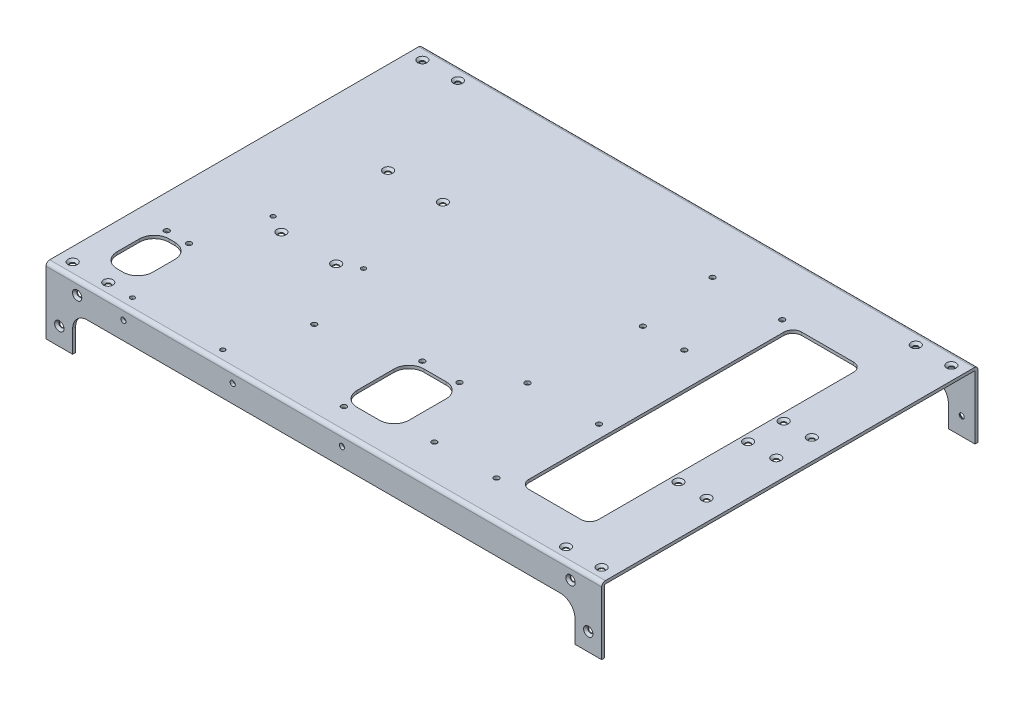
from build123d import *

# Parameters (mm, degrees)
BOSS_EXTRUDE1_DEPTH                             = 187.5
CUT_EXTRUDE1_DEPTH                              = 332.319332367
CUT_EXTRUDE4_DEPTH                              = 10
SKETCH6_R                                       = 1.5
CUT_EXTRUDE5_DEPTH                              = 319.900062716
SKETCH9_R                                       = 1.5
CUT_EXTRUDE8_DEPTH                              = 10
SKETCH19_R                                      = 1.5
CUT_EXTRUDE9_DEPTH                              = 10
SKETCH20_R                                      = 1.75
CUT_EXTRUDE10_DEPTH                             = 319.900062716
CSK_FOR_M3_FLAT_HEAD_MACHINE_SCREW1_D           = 3.4
CSK_FOR_M3_FLAT_HEAD_MACHINE_SCREW1_DEPTH       = 10
CSK_FOR_M3_FLAT_HEAD_MACHINE_SCREW1_CSINK_D     = 6.3
CSK_FOR_M3_FLAT_HEAD_MACHINE_SCREW1_CSINK_ANGLE = 90
CSK_FOR_M3_FLAT_HEAD_MACHINE_SCREW1_TIP         = 1.021463052
CSK_FOR_M3_FLAT_HEAD_MACHINE_SCREW2_D           = 3.4
CSK_FOR_M3_FLAT_HEAD_MACHINE_SCREW2_DEPTH       = 10
CSK_FOR_M3_FLAT_HEAD_MACHINE_SCREW2_CSINK_D     = 6.3
CSK_FOR_M3_FLAT_HEAD_MACHINE_SCREW2_CSINK_ANGLE = 90
CSK_FOR_M3_FLAT_HEAD_MACHINE_SCREW2_TIP         = 1.021463052
CSK_FOR_M3_FLAT_HEAD_MACHINE_SCREW3_D           = 3.4
CSK_FOR_M3_FLAT_HEAD_MACHINE_SCREW3_DEPTH       = 10
CSK_FOR_M3_FLAT_HEAD_MACHINE_SCREW3_CSINK_D     = 6.3
CSK_FOR_M3_FLAT_HEAD_MACHINE_SCREW3_CSINK_ANGLE = 90
CSK_FOR_M3_FLAT_HEAD_MACHINE_SCREW3_TIP         = 1.021463052
SKETCH28_R                                      = 1.75
CUT_EXTRUDE11_DEPTH                             = 10
SKETCH29_R                                      = 1.75
CUT_EXTRUDE12_DEPTH                             = 10
SKETCH30_R                                      = 1.75
CUT_EXTRUDE13_DEPTH                             = 231.508676626


with BuildPart() as part:
    # Sketch1 → Boss-Extrude1 (new, symmetric)
    with BuildSketch(Plane(origin=(0, 0, 0), x_dir=(0, 0, -1), z_dir=(1, 0, 0))):
        with BuildLine():
            Line((125, -100.5), (127, -100.5))
            Line((127, -100.5), (127, -2.5))
            ThreePointArc((127, -2.5), (126.267766953, -0.732233047), (124.5, 0))
            Line((124.5, 0), (-124.5, 0))
            ThreePointArc((-124.5, 0), (-126.267766953, -0.732233047), (-127, -2.5))
            Line((-127, -2.5), (-127, -100.5))
            Line((-127, -100.5), (-125, -100.5))
            Line((-125, -100.5), (-125, -2.5))
            ThreePointArc((-125, -2.5), (-124.853553391, -2.146446609), (-124.5, -2))
            Line((-124.5, -2), (124.5, -2))
            ThreePointArc((124.5, -2), (124.853553391, -2.146446609), (125, -2.5))
            Line((125, -2.5), (125, -100.5))
        make_face()
    extrude(amount=BOSS_EXTRUDE1_DEPTH, both=True)

    # Sketch2 → Cut-Extrude1 (cut, through all)
    with BuildSketch(Plane.XY.offset(127)):
        with BuildLine():
            Line((187.5, -45), (187.5, -100.5))
            Line((187.5, -100.5), (-187.5, -100.5))
            Line((-187.5, -100.5), (-187.5, -45))
            Line((-187.5, -45), (-169.5, -45))
            Line((-169.5, -45), (-169.5, -30))
            ThreePointArc((-169.5, -30), (-166.571067812, -22.928932188), (-159.5, -20))
            Line((-159.5, -20), (159.5, -20))
            ThreePointArc((159.5, -20), (166.571067812, -22.928932188), (169.5, -30))
            Line((169.5, -30), (169.5, -45))
            Line((169.5, -45), (187.5, -45))
        make_face()
    extrude(amount=-CUT_EXTRUDE1_DEPTH, mode=Mode.SUBTRACT)

    # Sketch5 → Cut-Extrude4 (cut)
    with BuildSketch(Plane.XZ.offset(2)):
        with BuildLine():
            Line((108.5, 97), (143.5, 97))
            ThreePointArc((143.5, 97), (147.742640687, 95.242640687), (149.5, 91))
            Line((149.5, 91), (149.5, -81))
            ThreePointArc((149.5, -81), (147.742640687, -85.242640687), (143.5, -87))
            Line((143.5, -87), (108.5, -87))
            ThreePointArc((108.5, -87), (104.257359313, -85.242640687), (102.5, -81))
            Line((102.5, -81), (102.5, 91))
            ThreePointArc((102.5, 91), (104.257359313, 95.242640687), (108.5, 97))
        make_face()
    extrude(amount=-CUT_EXTRUDE4_DEPTH, mode=Mode.SUBTRACT)

    # Sketch6 → Cut-Extrude5 (cut, through all)
    with BuildSketch(Plane(origin=(0, 0, -127), x_dir=(-1, 0, 0), z_dir=(0, 0, -1))):
        with Locations((-178.5, -33)):
            Circle(SKETCH6_R)
        with Locations((-166.5, -9)):
            Circle(SKETCH6_R)
        with Locations((166.5, -9)):
            Circle(SKETCH6_R)
        with Locations((178.5, -33)):
            Circle(SKETCH6_R)
    extrude(amount=-CUT_EXTRUDE5_DEPTH, mode=Mode.SUBTRACT)

    # Sketch9 → Cut-Extrude8 (cut)
    with BuildSketch(Plane(origin=(0, 0, 0), x_dir=(1, 0, 0), z_dir=(0, 1, 0))):
        with Locations(Location((-178.5, 118, 0), (0, 0, 270))):
            Circle(SKETCH9_R)
        with Locations(Location((-154.5, 118, 0), (0, 0, 270))):
            Circle(SKETCH9_R)
        with Locations(Location((154.5, 118, 0), (0, 0, 270))):
            Circle(SKETCH9_R)
        with Locations(Location((178.5, 118, 0), (0, 0, 270))):
            Circle(SKETCH9_R)
        with Locations(Location((178.5, -118, 0), (0, 0, 270))):
            Circle(SKETCH9_R)
        with Locations(Location((154.5, -118, 0), (0, 0, 270))):
            Circle(SKETCH9_R)
        with Locations(Location((-154.5, -118, 0), (0, 0, 270))):
            Circle(SKETCH9_R)
        with Locations(Location((-178.5, -118, 0), (0, 0, 270))):
            Circle(SKETCH9_R)
        with Locations(Location((-125.5, 41.85, 0), (0, 0, 270))):
            Circle(SKETCH9_R)
        with Locations(Location((-88.5, 41.85, 0), (0, 0, 270))):
            Circle(SKETCH9_R)
        with Locations(Location((-125.5, -30.15, 0), (0, 0, 270))):
            Circle(SKETCH9_R)
        with Locations(Location((-88.5, -30.15, 0), (0, 0, 270))):
            Circle(SKETCH9_R)
        with Locations(Location((154.5, 28.85, 0), (0, 0, 270))):
            Circle(SKETCH9_R)
        with Locations(Location((173.5, 4.85, 0), (0, 0, 270))):
            Circle(SKETCH9_R)
        with Locations(Location((154.5, 4.85, 0), (0, 0, 270))):
            Circle(SKETCH9_R)
        with Locations(Location((173.5, 28.85, 0), (0, 0, 270))):
            Circle(SKETCH9_R)
        with Locations(Location((154.5, -42.15, 0), (0, 0, 270))):
            Circle(SKETCH9_R)
        with Locations(Location((173.5, -42.15, 0), (0, 0, 270))):
            Circle(SKETCH9_R)
    extrude(amount=-CUT_EXTRUDE8_DEPTH, mode=Mode.SUBTRACT)

    # Sketch19 → Cut-Extrude9 (cut)
    with BuildSketch(Plane(origin=(0, 0, 0), x_dir=(1, 0, 0), z_dir=(0, 1, 0))):
        with Locations(Location((-137.5, -23.7, 0), (0, 0, 270))):
            Circle(SKETCH19_R)
        with Locations(Location((-76.5, -23.7, 0), (0, 0, 270))):
            Circle(SKETCH19_R)
        with Locations(Location((-76.5, -118.7, 0), (0, 0, 270))):
            Circle(SKETCH19_R)
        with Locations(Location((-137.5, -118.7, 0), (0, 0, 270))):
            Circle(SKETCH19_R)
    extrude(amount=-CUT_EXTRUDE9_DEPTH, mode=Mode.SUBTRACT)

    # Sketch20 → Cut-Extrude10 (cut, through all)
    with BuildSketch(Plane(origin=(0, 0, -127), x_dir=(-1, 0, 0), z_dir=(0, 0, -1))):
        with Locations((-12.25, -8)):
            Circle(SKETCH20_R)
        with Locations((61.5, -8)):
            Circle(SKETCH20_R)
        with Locations((135.25, -8)):
            Circle(SKETCH20_R)
    extrude(amount=-CUT_EXTRUDE10_DEPTH, mode=Mode.SUBTRACT)

    # CSK for M3 Flat Head Machine Screw1
    with Locations(Plane.XY.offset(127)):
        with Locations((-166.5, -9), (166.5, -9), (178.5, -33), (-178.5, -33)):
            CounterSinkHole(CSK_FOR_M3_FLAT_HEAD_MACHINE_SCREW1_D / 2, CSK_FOR_M3_FLAT_HEAD_MACHINE_SCREW1_CSINK_D / 2, depth=CSK_FOR_M3_FLAT_HEAD_MACHINE_SCREW1_DEPTH, counter_sink_angle=CSK_FOR_M3_FLAT_HEAD_MACHINE_SCREW1_CSINK_ANGLE)
            with Locations((0, 0, -(CSK_FOR_M3_FLAT_HEAD_MACHINE_SCREW1_DEPTH + CSK_FOR_M3_FLAT_HEAD_MACHINE_SCREW1_TIP / 2))):  # 118° drill point
                Cone(0, CSK_FOR_M3_FLAT_HEAD_MACHINE_SCREW1_D / 2, CSK_FOR_M3_FLAT_HEAD_MACHINE_SCREW1_TIP, mode=Mode.SUBTRACT)

    # CSK for M3 Flat Head Machine Screw2
    with Locations(Plane(origin=(0, 0, -127), x_dir=(-1, 0, 0), z_dir=(0, 0, -1))):
        with Locations((-166.5, -9), (178.5, -33), (166.5, -9), (-178.5, -33)):
            CounterSinkHole(CSK_FOR_M3_FLAT_HEAD_MACHINE_SCREW2_D / 2, CSK_FOR_M3_FLAT_HEAD_MACHINE_SCREW2_CSINK_D / 2, depth=CSK_FOR_M3_FLAT_HEAD_MACHINE_SCREW2_DEPTH, counter_sink_angle=CSK_FOR_M3_FLAT_HEAD_MACHINE_SCREW2_CSINK_ANGLE)
            with Locations((0, 0, -(CSK_FOR_M3_FLAT_HEAD_MACHINE_SCREW2_DEPTH + CSK_FOR_M3_FLAT_HEAD_MACHINE_SCREW2_TIP / 2))):  # 118° drill point
                Cone(0, CSK_FOR_M3_FLAT_HEAD_MACHINE_SCREW2_D / 2, CSK_FOR_M3_FLAT_HEAD_MACHINE_SCREW2_TIP, mode=Mode.SUBTRACT)

    # CSK for M3 Flat Head Machine Screw3
    with Locations(Plane(origin=(0, 0, 0), x_dir=(-1, 0, 0), z_dir=(0, 1, 0))):
        with Locations((88.5, -41.85), (178.5, -118), (154.5, -118), (125.5, -41.85), (125.5, 30.15), (88.5, 30.15), (178.5, 118), (154.5, 118), (-154.5, 118), (-178.5, 118), (-154.5, 42.15), (-173.5, 42.15), (-173.5, -4.85), (-154.5, -4.85), (-173.5, -28.85), (-154.5, -28.85), (-178.5, -118), (-154.5, -118)):
            CounterSinkHole(CSK_FOR_M3_FLAT_HEAD_MACHINE_SCREW3_D / 2, CSK_FOR_M3_FLAT_HEAD_MACHINE_SCREW3_CSINK_D / 2, depth=CSK_FOR_M3_FLAT_HEAD_MACHINE_SCREW3_DEPTH, counter_sink_angle=CSK_FOR_M3_FLAT_HEAD_MACHINE_SCREW3_CSINK_ANGLE)
            with Locations((0, 0, -(CSK_FOR_M3_FLAT_HEAD_MACHINE_SCREW3_DEPTH + CSK_FOR_M3_FLAT_HEAD_MACHINE_SCREW3_TIP / 2))):  # 118° drill point
                Cone(0, CSK_FOR_M3_FLAT_HEAD_MACHINE_SCREW3_D / 2, CSK_FOR_M3_FLAT_HEAD_MACHINE_SCREW3_TIP, mode=Mode.SUBTRACT)

    # Sketch28 → Cut-Extrude11 (cut)
    with BuildSketch(Plane(origin=(0, 0, 0), x_dir=(-1, 0, 0), z_dir=(0, 1, 0))):
        with Locations(Location((2.5, 111, 0), (0, 0, 90))):
            Circle(SKETCH28_R)
        with Locations(Location((2.5, 58, 0), (0, 0, 90))):
            Circle(SKETCH28_R)
        with Locations(Location((-22.5, 58, 0), (0, 0, 90))):
            Circle(SKETCH28_R)
        with Locations(Location((150, 68, 0), (0, 0, 90))):
            Circle(SKETCH28_R)
        with Locations(Location((165, 68, 0), (0, 0, 90))):
            Circle(SKETCH28_R)
        with BuildLine():
            Line((-2.5, 62), (-17.5, 62))
            ThreePointArc((-17.5, 62), (-24.571067812, 64.928932188), (-27.5, 72))
            Line((-27.5, 72), (-27.5, 97))
            ThreePointArc((-27.5, 97), (-24.571067812, 104.071067812), (-17.5, 107))
            Line((-17.5, 107), (-2.5, 107))
            ThreePointArc((-2.5, 107), (4.571067812, 104.071067812), (7.5, 97))
            Line((7.5, 97), (7.5, 72))
            ThreePointArc((7.5, 72), (4.571067812, 64.928932188), (-2.5, 62))
        make_face()
        with BuildLine():
            Line((155.5, 107), (159.5, 107))
            ThreePointArc((159.5, 107), (166.571067812, 104.071067812), (169.5, 97))
            Line((169.5, 97), (169.5, 82))
            ThreePointArc((169.5, 82), (166.571067812, 74.928932188), (159.5, 72))
            Line((159.5, 72), (155.5, 72))
            ThreePointArc((155.5, 72), (148.428932188, 74.928932188), (145.5, 82))
            Line((145.5, 82), (145.5, 97))
            ThreePointArc((145.5, 97), (148.428932188, 104.071067812), (155.5, 107))
        make_face()
    extrude(amount=-CUT_EXTRUDE11_DEPTH, mode=Mode.SUBTRACT)

    # Sketch29 → Cut-Extrude12 (cut)
    with BuildSketch(Plane.XZ.offset(2)):
        with Locations(Location((48.87606739, 101.261331894, 0), (0, 0, 270))):
            Circle(SKETCH29_R)
        with Locations(Location((90.786066711, 101.253791257, 0), (0, 0, 270))):
            Circle(SKETCH29_R)
        with Locations(Location((45.689185225, 35.221904223, 0), (0, 0, 270))):
            Circle(SKETCH29_R)
        with Locations(Location((93.949184444, 35.213221065, 0), (0, 0, 270))):
            Circle(SKETCH29_R)
        with Locations(Location((51.527, -36.839, 0), (0, 0, 270))):
            Circle(SKETCH29_R)
        with Locations(Location((79.467, -36.839, 0), (0, 0, 270))):
            Circle(SKETCH29_R)
        with Locations(Location((46.447, -88.91, 0), (0, 0, 270))):
            Circle(SKETCH29_R)
        with Locations(Location((94.707, -87.639, 0), (0, 0, 270))):
            Circle(SKETCH29_R)
    extrude(amount=-CUT_EXTRUDE12_DEPTH, mode=Mode.SUBTRACT)

    # Sketch30 → Cut-Extrude13 (cut, through all)
    with BuildSketch(Plane.XZ.offset(2)):
        with Locations(Location((-60.5, 73, 0), (0, 0, 270))):
            Circle(SKETCH30_R)
    extrude(amount=-CUT_EXTRUDE13_DEPTH, mode=Mode.SUBTRACT)


solid = part.part
